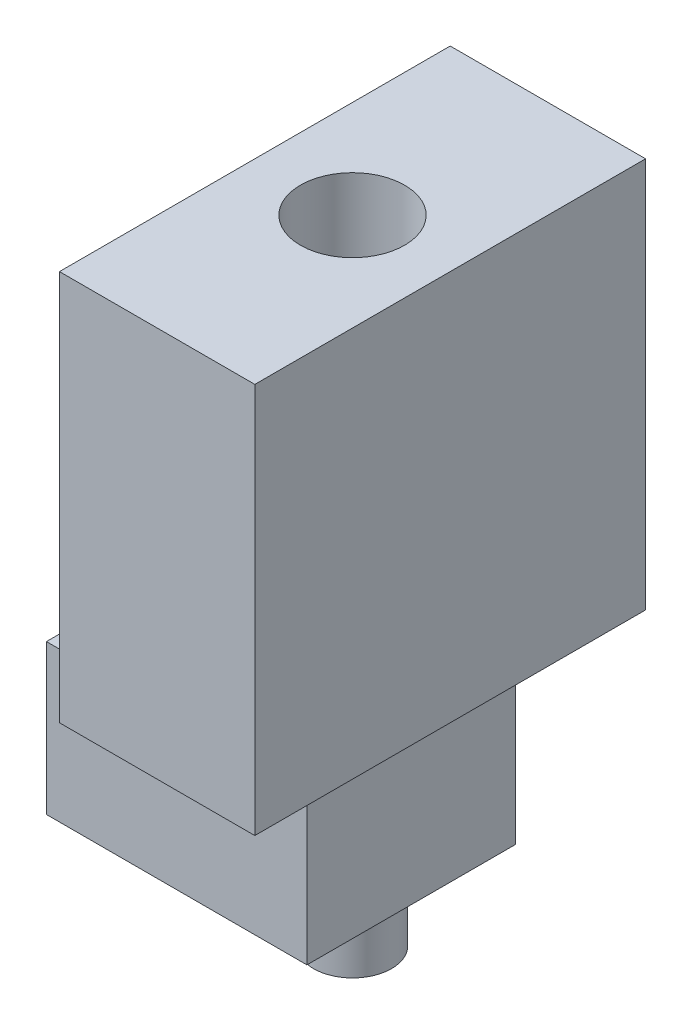
from build123d import *

# Parameters (mm, degrees)
SKETCH_1_W            = 30
SKETCH_1_H            = 30
EXTRUDE_1_DEPTH       = 15
HOLE_WIZARD_8_0_8_1_D = 8
SKETCH_4_R            = 4
EXTRUDE_2_DEPTH       = 0.1
SKETCH_5_R            = 1.5
EXTRUDE_3_DEPTH       = 2
SKETCH_6_W            = 20
SKETCH_6_H            = 16
EXTRUDE_4_DEPTH       = 11.5
SKETCH_7_R            = 3
EXTRUDE_5_DEPTH       = 5


with BuildPart() as part:
    # Эскиз1 → Бобышка-Вытянуть1 (new body)
    with BuildSketch(Plane(origin=(0, 0, 0), x_dir=(0, 0, -1), z_dir=(1, 0, 0))):
        with Locations((15, 15)):
            Rectangle(SKETCH_1_W, SKETCH_1_H)
    extrude(amount=EXTRUDE_1_DEPTH)

    # Диаметр отверстия Ø8.0 (8)1 (through all)
    with Locations(Plane(origin=(0, 30, 0), x_dir=(1, 0, 0), z_dir=(0, 1, 0))):
        with Locations((7.5, 15)):
            Hole(HOLE_WIZARD_8_0_8_1_D / 2)


with BuildPart() as body_2:
    # Эскиз4 → Бобышка-Вытянуть2 (new body)
    with BuildSketch(Plane.XZ):
        with Locations(Location((7.5, -15, 0), (0, 0, 270))):
            Circle(SKETCH_4_R)
    extrude(amount=EXTRUDE_2_DEPTH)

    # Эскиз5 → Бобышка-Вытянуть3 (add)
    with BuildSketch(Plane.XZ.offset(0.1)):
        with Locations(Location((7.5, -15, 0), (0, 0, 270))):
            Circle(SKETCH_5_R)
    extrude(amount=EXTRUDE_3_DEPTH)

    # Эскиз6 → Бобышка-Вытянуть4 (add)
    with BuildSketch(Plane.XZ.offset(2.1)):
        with Locations((2, -15)):
            Rectangle(SKETCH_6_W, SKETCH_6_H)
    extrude(amount=EXTRUDE_4_DEPTH)

    # Эскиз7 → Бобышка-Вытянуть5 (add)
    with BuildSketch(Plane.XZ.offset(13.6)):
        with Locations(Location((7.5, -15, 0), (0, 0, 270))):
            Circle(SKETCH_7_R)
    extrude(amount=EXTRUDE_5_DEPTH)


solid = Compound([part.part, body_2.part])
